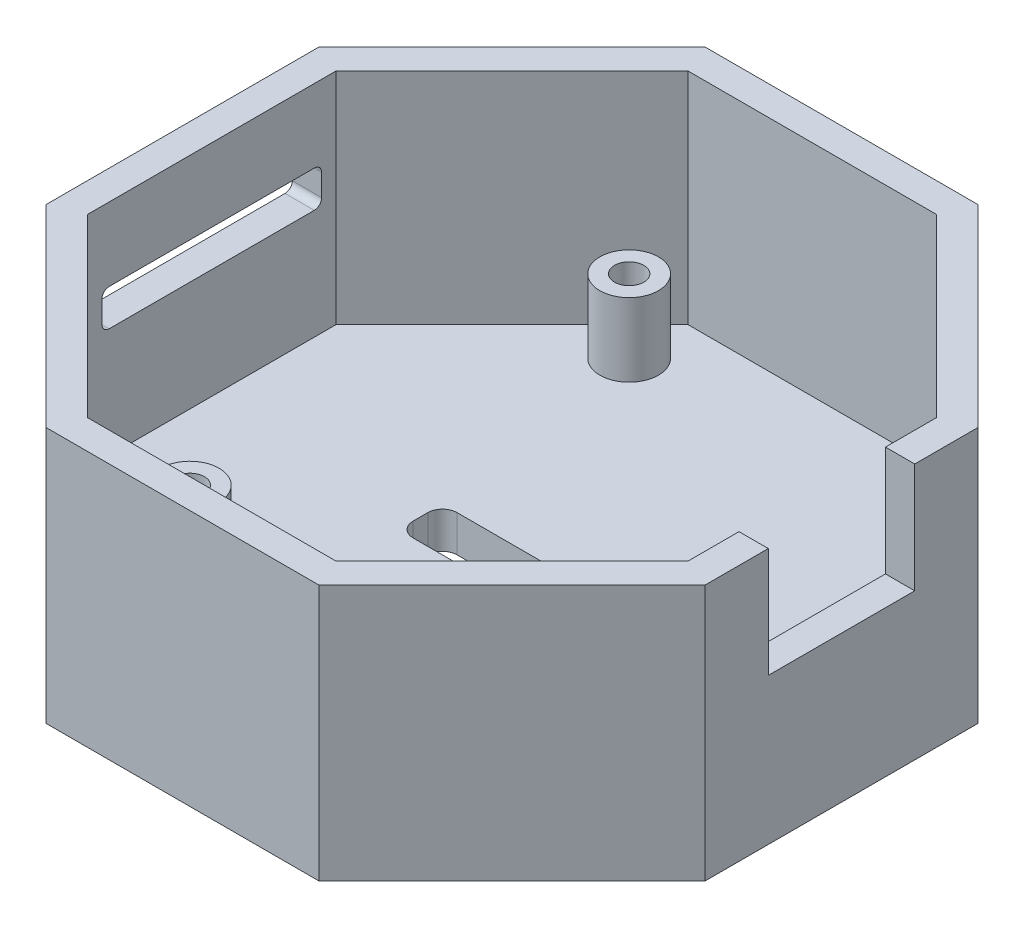
from build123d import *

# Parameters (mm, degrees)
EXTRUDE_1_DEPTH     = 5
EXTRUDE_3_DEPTH     = 30
SKETCH_6_R          = 4
SKETCH_6_R_2        = 2
EXTRUDE_4_DEPTH     = 10
CUT_EXTRUDE_1_DEPTH = 10
CUT_EXTRUDE_3_DEPTH = 10
CUT_EXTRUDE_4_DEPTH = 15


with BuildPart() as part:
    # 草图1 → 凸台-拉伸1 (new body)
    with BuildSketch(Plane(origin=(0, 0, 0), x_dir=(1, 0, 0), z_dir=(0, 1, 0))):
        Polygon((45, 18.639610307), (18.639610307, 45), (-18.639610307, 45), (-45, 18.639610307), (-45, -18.639610307), (-18.639610307, -45), (18.639610307, -45), (45, -18.639610307), align=None)
    extrude(amount=EXTRUDE_1_DEPTH)

    # 草图5 → 凸台-拉伸3 (add)
    with BuildSketch(Plane(origin=(0, 5, 0), x_dir=(1, 0, 0), z_dir=(0, 1, 0))):
        Polygon((45, -18.639610307), (45, 18.639610307), (18.639610307, 45), (-18.639610307, 45), (-45, 18.639610307), (-45, -18.639610307), (-18.639610307, -45), (18.639610307, -45), align=None)
        Polygon((41, 16.982756057), (16.982756057, 41), (-16.982756057, 41), (-41, 16.982756057), (-41, -16.982756057), (-16.982756057, -41), (16.982756057, -41), (41, -16.982756057), align=None, mode=Mode.SUBTRACT)
    extrude(amount=EXTRUDE_3_DEPTH)

    # 草图6 → 凸台-拉伸4 (add)
    # profile 1 of 3: a face of its own
    with BuildSketch(Plane(origin=(0, 5, 0), x_dir=(1, 0, 0), z_dir=(0, 1, 0))):
        with Locations(Location((-17, 33, 0), (0, 0, 270))):
            Circle(SKETCH_6_R)
        with Locations(Location((-17, 33, 0), (0, 0, 270))):
            Circle(SKETCH_6_R_2, mode=Mode.SUBTRACT)
    # profile 2 of 3: a face of its own
    with BuildSketch(Plane(origin=(0, 5, 0), x_dir=(1, 0, 0), z_dir=(0, 1, 0))):
        with Locations(Location((10, -33, 0), (0, 0, 270))):
            Circle(SKETCH_6_R)
        with Locations(Location((10, -33, 0), (0, 0, 270))):
            Circle(SKETCH_6_R_2, mode=Mode.SUBTRACT)
    # profile 3 of 3: a face of its own
    with BuildSketch(Plane(origin=(0, 5, 0), x_dir=(1, 0, 0), z_dir=(0, 1, 0))):
        with Locations(Location((-22, -22, 0), (0, 0, 270))):
            Circle(SKETCH_6_R)
        with Locations(Location((-22, -22, 0), (0, 0, 270))):
            Circle(SKETCH_6_R_2, mode=Mode.SUBTRACT)
    extrude(amount=EXTRUDE_4_DEPTH)

    # 草图7 → 切除-拉伸1 (cut)
    with BuildSketch(Plane(origin=(0, 5, 0), x_dir=(1, 0, 0), z_dir=(0, 1, 0))):
        with BuildLine():
            ThreePointArc((10.5, 3), (11.914213562, 2.414213562), (12.5, 1))
            Line((12.5, 1), (12.5, -1))
            ThreePointArc((12.5, -1), (11.914213562, -2.414213562), (10.5, -3))
            Line((10.5, -3), (-10.5, -3))
            ThreePointArc((-10.5, -3), (-11.914213562, -2.414213562), (-12.5, -1))
            Line((-12.5, -1), (-12.5, 1))
            ThreePointArc((-12.5, 1), (-11.914213562, 2.414213562), (-10.5, 3))
            Line((-10.5, 3), (10.5, 3))
        make_face()
    extrude(amount=-CUT_EXTRUDE_1_DEPTH, mode=Mode.SUBTRACT)

    # 草图10 → 切除-拉伸3 (cut)
    with BuildSketch(Plane.ZY.offset(45)):
        with BuildLine():
            Line((0, 20), (14, 20))
            ThreePointArc((14, 20), (14.707106781, 20.292893219), (15, 21))
            Line((15, 21), (15, 24))
            ThreePointArc((15, 24), (14.707106781, 24.707106781), (14, 25))
            Line((14, 25), (-14, 25))
            ThreePointArc((-14, 25), (-14.707106781, 24.707106781), (-15, 24))
            Line((-15, 24), (-15, 21))
            ThreePointArc((-15, 21), (-14.707106781, 20.292893219), (-14, 20))
            Line((-14, 20), (0, 20))
        make_face()
    extrude(amount=-CUT_EXTRUDE_3_DEPTH, mode=Mode.SUBTRACT)

    # 草图11 → 切除-拉伸4 (cut)
    with BuildSketch(Plane(origin=(0, 35, 0), x_dir=(1, 0, 0), z_dir=(0, 1, 0))):
        Polygon((41, 0), (41, 10), (45, 10), (45, -10), (41, -10), align=None)
    extrude(amount=-CUT_EXTRUDE_4_DEPTH, mode=Mode.SUBTRACT)


solid = part.part
